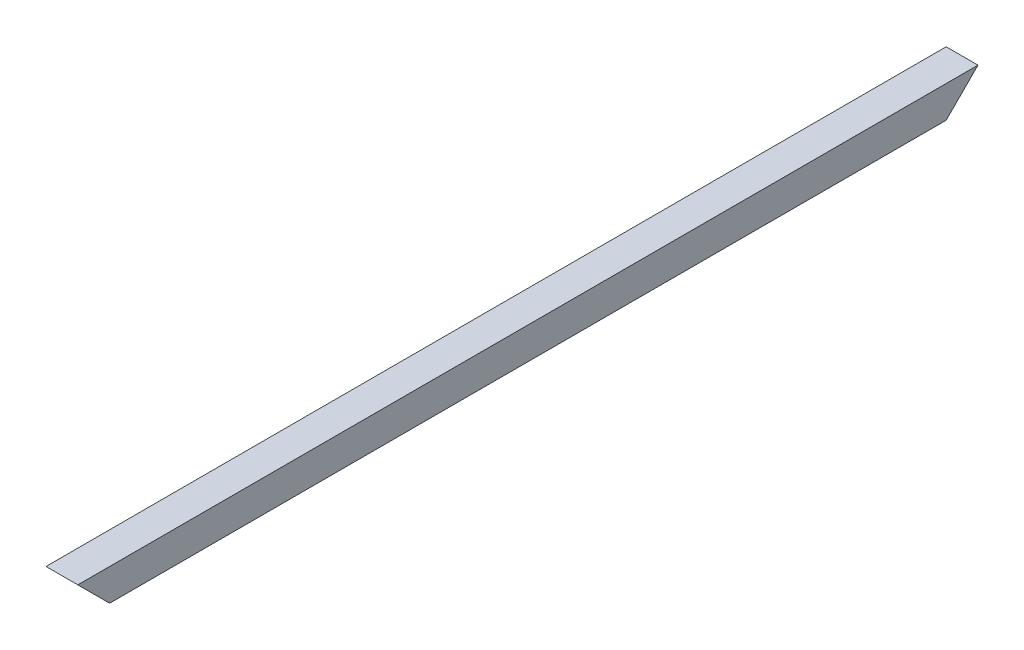
from build123d import *

# Parameters (mm, degrees)
SKETCH1_W           = 50
SKETCH1_H           = 50
SKETCH1_W_2         = 46
SKETCH1_H_2         = 46
BOSS_EXTRUDE1_DEPTH = 1414.3
CUT_EXTRUDE1_DEPTH  = 1416.404355652


with BuildPart() as part:
    # Sketch1 → Boss-Extrude1 (new body)
    with BuildSketch(Plane.XY):
        Rectangle(SKETCH1_W, SKETCH1_H)
        Rectangle(SKETCH1_W_2, SKETCH1_H_2, mode=Mode.SUBTRACT)
    extrude(amount=BOSS_EXTRUDE1_DEPTH)

    # Sketch2 → Cut-Extrude1 (cut, through all)
    with BuildSketch(Plane(origin=(25, 0, 0), x_dir=(0, 0, -1), z_dir=(1, 0, 0))):
        Polygon((-1414.3, 25), (-1414.3, -25), (-1364.3, -25), align=None)
        Polygon((0, 25), (0, -25), (-50, -25), align=None)
    extrude(amount=-CUT_EXTRUDE1_DEPTH, mode=Mode.SUBTRACT)


solid = part.part
